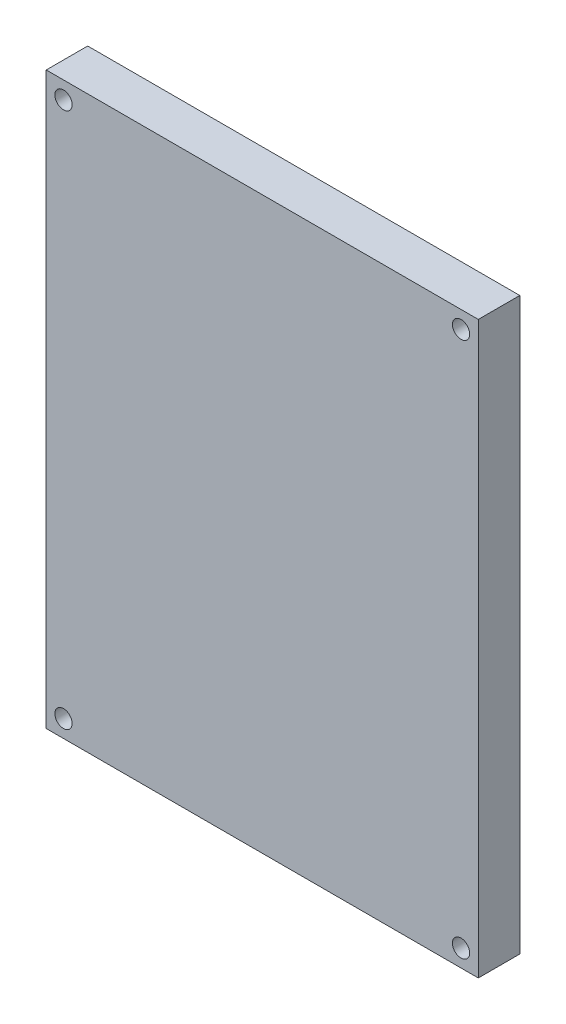
from build123d import *

# Parameters (mm, degrees)
SKIZZE1_W                       = 62.5
SKIZZE1_H                       = 82.5
AUFSATZ_LINEAR_AUSTRAGEN1_DEPTH = 4
AUFSATZ_LINEAR_START            = -4
SKIZZE2_W                       = 5
SKIZZE2_H                       = 5
SKIZZE2_R                       = 1.25
AUFSATZ_LINEAR_AUSTRAGEN2_DEPTH = 4
SKIZZE3_W                       = 62.5
SKIZZE3_H                       = 82.5
AUFSATZ_LINEAR_AUSTRAGEN3_DEPTH = 2
SKIZZE2_2_R                     = 1.25
SCHNITT_LINEAR_AUSTRAGEN1_DEPTH = 5
SCHNITT_LINEAR_START            = -2
SKIZZE4_R                       = 1.25
SCHNITT_LINEAR_AUSTRAGEN2_DEPTH = 2
SKIZZE5_W                       = 12.5
SKIZZE5_H                       = 2
SCHNITT_LINEAR_AUSTRAGEN3_DEPTH = 4


with BuildPart() as part:
    # Skizze1 → Aufsatz-Linear austragen1 (new body)
    with BuildSketch(Plane.XY):
        with Locations((1.25, -6.25)):
            Rectangle(SKIZZE1_W, SKIZZE1_H)
        with BuildLine():
            ThreePointArc((-28, 31.354356), (-26.616117, 31.616117), (-26.354356, 33))
            Line((-26.354356, 33), (28.854356, 33))
            ThreePointArc((28.854356, 33), (29.116117, 31.616117), (30.5, 31.354356))
            Line((30.5, 31.354356), (30.5, -43.854356))
            ThreePointArc((30.5, -43.854356), (29.116117, -44.116117), (28.854356, -45.5))
            Line((28.854356, -45.5), (-26.354356, -45.5))
            ThreePointArc((-26.354356, -45.5), (-26.616117, -44.116117), (-28, -43.854356))
            Line((-28, -43.854356), (-28, 31.354356))
        make_face(mode=Mode.SUBTRACT)
    extrude(amount=AUFSATZ_LINEAR_AUSTRAGEN1_DEPTH)

    # Skizze2 → Aufsatz-Linear austragen2 (add)
    # profile 1 of 4: a face of its own
    with BuildSketch(Plane.XY.offset(4).offset(AUFSATZ_LINEAR_START)):
        with Locations((-27.5, -45)):
            Rectangle(SKIZZE2_W, SKIZZE2_H)
        with Locations((-27.5, -45)):
            Circle(SKIZZE2_R, mode=Mode.SUBTRACT)
    # profile 2 of 4: a face of its own
    with BuildSketch(Plane.XY.offset(4).offset(AUFSATZ_LINEAR_START)):
        with Locations((30, -45)):
            Rectangle(SKIZZE2_W, SKIZZE2_H)
        with Locations((30, -45)):
            Circle(SKIZZE2_R, mode=Mode.SUBTRACT)
    # profile 3 of 4: a face of its own
    with BuildSketch(Plane.XY.offset(4).offset(AUFSATZ_LINEAR_START)):
        with Locations((30, 32.5)):
            Rectangle(SKIZZE2_W, SKIZZE2_H)
        with Locations((30, 32.5)):
            Circle(SKIZZE2_R, mode=Mode.SUBTRACT)
    # profile 4 of 4: a face of its own
    with BuildSketch(Plane.XY.offset(4).offset(AUFSATZ_LINEAR_START)):
        with Locations((-27.5, 32.5)):
            Rectangle(SKIZZE2_W, SKIZZE2_H)
        with Locations((-27.5, 32.5)):
            Circle(SKIZZE2_R, mode=Mode.SUBTRACT)
    extrude(amount=AUFSATZ_LINEAR_AUSTRAGEN2_DEPTH)

    # Skizze3 → Aufsatz-Linear austragen3 (add)
    with BuildSketch(Plane.XY.offset(4)):
        with Locations((1.25, -6.25)):
            Rectangle(SKIZZE3_W, SKIZZE3_H)
    extrude(amount=AUFSATZ_LINEAR_AUSTRAGEN3_DEPTH)

    # Skizze2<2> → Schnitt-Linear austragen1 (cut)
    with BuildSketch(Plane.XY.offset(4)):
        with BuildLine():
            ThreePointArc((-26.354356, -45.5), (-26.276367, -45.255387), (-26.25, -45))
            ThreePointArc((-26.25, -45), (-26.815347, -43.954175), (-28, -43.854356))
            ThreePointArc((-28, -43.854356), (-28.383883, -45.883883), (-26.354356, -45.5))
        make_face()
        with BuildLine():
            ThreePointArc((30.5, 31.354356), (31.045825, 31.815347), (31.25, 32.5))
            ThreePointArc((31.25, 32.5), (30.255387, 33.723633), (28.854356, 33))
            ThreePointArc((28.854356, 33), (29.116117, 31.616117), (30.5, 31.354356))
        make_face()
        with BuildLine():
            ThreePointArc((-28, 31.354356), (-26.815347, 31.454175), (-26.25, 32.5))
            ThreePointArc((-26.25, 32.5), (-26.276367, 32.755387), (-26.354356, 33))
            ThreePointArc((-26.354356, 33), (-28.383883, 33.383883), (-28, 31.354356))
        make_face()
        with Locations((30, -45)):
            Circle(SKIZZE2_2_R)
    extrude(amount=-SCHNITT_LINEAR_AUSTRAGEN1_DEPTH, mode=Mode.SUBTRACT)

    # Skizze4 → Schnitt-Linear austragen2 (cut)
    with BuildSketch(Plane(origin=(0, 0, 4), x_dir=(-1, 0, 0), z_dir=(0, 0, -1)).offset(SCHNITT_LINEAR_START)):
        with Locations(Location((27.5, 32.5, 0), (0, 0, 180))):
            Circle(SKIZZE4_R)
        with Locations(Location((27.5, -45, 0), (0, 0, 180))):
            Circle(SKIZZE4_R)
        with Locations(Location((-30, -45, 0), (0, 0, 180))):
            Circle(SKIZZE4_R)
        with Locations(Location((-30, 32.5, 0), (0, 0, 180))):
            Circle(SKIZZE4_R)
    extrude(amount=SCHNITT_LINEAR_AUSTRAGEN2_DEPTH, mode=Mode.SUBTRACT)

    # Skizze5 → Schnitt-Linear austragen3 (cut)
    with BuildSketch(Plane(origin=(0, 0, 0), x_dir=(-1, 0, 0), z_dir=(0, 0, -1))):
        with Locations((-1.25, -46.5)):
            Rectangle(SKIZZE5_W, SKIZZE5_H)
    extrude(amount=-SCHNITT_LINEAR_AUSTRAGEN3_DEPTH, mode=Mode.SUBTRACT)


solid = part.part
